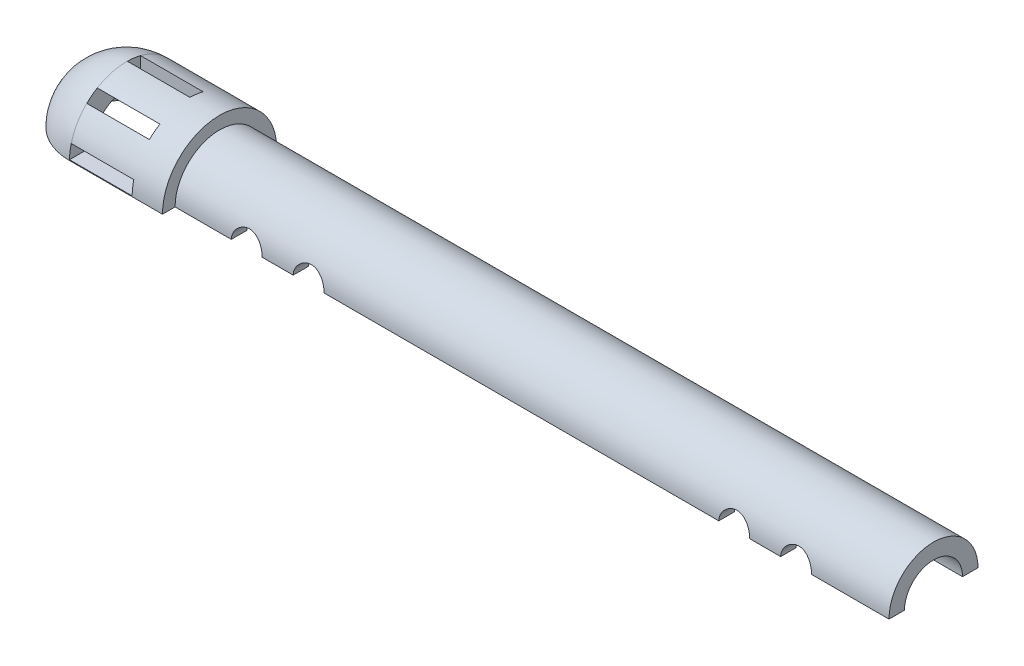
from build123d import *

# Parameters (mm, degrees)
REVOLVE6_ANGLE          = 180
SKETCH2_W               = 8.091492299
SKETCH2_H               = 1.703338147
CUT_EXTRUDE1_DEPTH      = 10
CIRPATTERN1_COUNT       = 8
CUT_EXTRUDE4_DEPTH      = 80.570407996
CUT_EXTRUDE4_DEPTH_BACK = 80.570407996
SKETCH3_R               = 2


with BuildPart() as part:
    # Sketch1 → Revolve6 (revolve)
    with BuildSketch(Plane(origin=(0, 0, 0), x_dir=(1, 0, 0), z_dir=(0, 1, 0))):
        with BuildLine():
            Line((-7.909078058, 1.25), (72.378975497, 1.25))
            Line((72.378975497, 1.25), (72.378975497, 0))
            Line((72.378975497, 0), (74.608975497, 0))
            Line((74.608975497, 0), (74.608975497, 1.25))
            Line((74.608975497, 1.25), (78.608975497, 1.25))
            Line((78.608975497, 1.25), (78.608975497, 3.25))
            Line((78.608975497, 3.25), (74.913959146, 3.25))
            Line((74.913959146, 3.25), (-13.655190787, 3.25))
            Line((-13.655190787, 3.25), (-13.655190787, 4.88))
            Line((-13.655190787, 4.88), (-16.655190787, 4.88))
            Line((-16.655190787, 4.88), (-25.666337235, 4.88))
            ThreePointArc((-25.666337235, 4.88), (-30.88478528, 2.718448045), (-33.046337235, -2.5))
            Line((-33.046337235, -2.5), (-30.045517155, -2.5))
            ThreePointArc((-30.045517155, -2.5), (-28.762885052, 0.596547817), (-25.666337235, 1.87917992))
            Line((-25.666337235, 1.87917992), (-16.655190787, 1.87917992))
            Line((-16.655190787, 1.87917992), (-16.655190787, 1.25))
            Line((-16.655190787, 1.25), (-12.635190787, 1.25))
            Line((-12.635190787, 1.25), (-12.635190787, 0))
            Line((-12.635190787, 0), (-10.905190787, 0))
            Line((-10.905190787, 0), (-10.905190787, 1.25))
            Line((-10.905190787, 1.25), (-7.909078058, 1.25))
        make_face()
    revolve(axis=Axis((-33.046337235, 0, 2.5), (1, 0, 0)), revolution_arc=REVOLVE6_ANGLE)

    # Sketch2 → Cut-Extrude1 (cut)
    with BuildSketch(Plane(origin=(0, 0, 0), x_dir=(1, 0, 0), z_dir=(0, 1, 0))):
        with Locations((-21.620591086, -1.552211442)):
            Rectangle(SKETCH2_W, SKETCH2_H)
    cut_extrude1 = extrude(amount=CUT_EXTRUDE1_DEPTH, mode=Mode.SUBTRACT)

    # CirPattern1: Cut-Extrude1 ×8 about axis
    cirpattern1_axis = Axis((0, 0, 2.5), (1, 0, 0))
    for i in range(1, CIRPATTERN1_COUNT):
        add(cut_extrude1.rotate(cirpattern1_axis, i * 360 / CIRPATTERN1_COUNT), mode=Mode.SUBTRACT)

    # Sketch3 → Cut-Extrude4 (cut, two sides: drawn at the far end of the back side and taken through both)
    with BuildSketch(Plane.XY.offset(-CUT_EXTRUDE4_DEPTH_BACK)):
        with Locations((66.608975497, 0)):
            Circle(SKETCH3_R)
        with Locations((58.608975497, 0)):
            Circle(SKETCH3_R)
        with Locations((3.608975497, 0)):
            Circle(SKETCH3_R)
        with Locations((-4.391024503, 0)):
            Circle(SKETCH3_R)
    extrude(amount=CUT_EXTRUDE4_DEPTH + CUT_EXTRUDE4_DEPTH_BACK, mode=Mode.SUBTRACT)


solid = part.part
